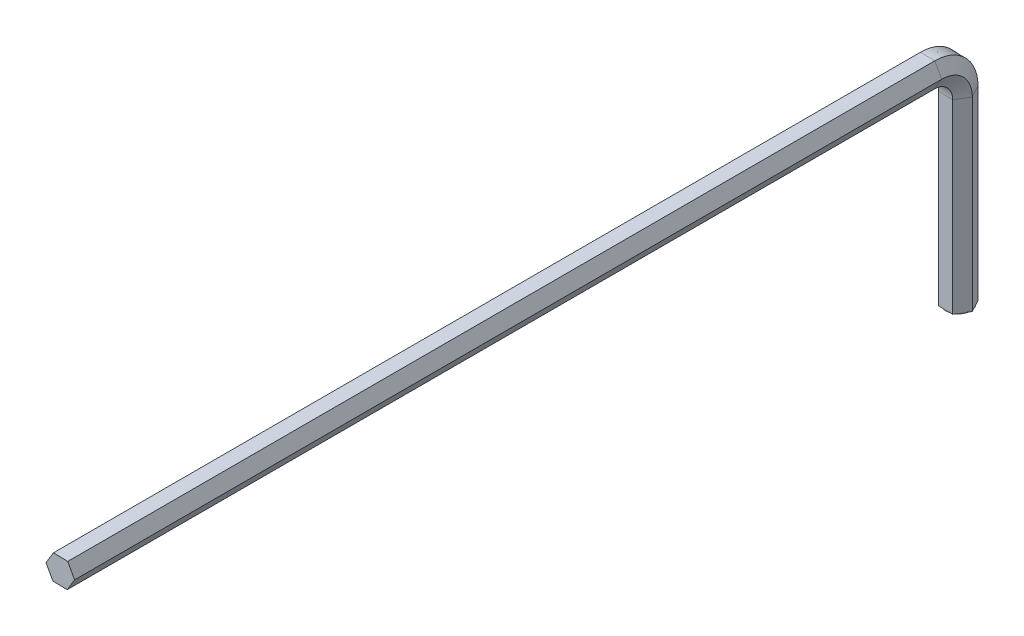
from build123d import *

# Parameters (mm, degrees)
SKETCH2_R           = 2
BOSS_EXTRUDE1_DEPTH = 0.1


with BuildPart() as part:
    # Sweep1: sweep along a curve in space
    with BuildLine() as sweep1_path:
        Line((0, 0, 0), (0, 30, 0))
        ThreePointArc((0, 35, 5), (0, 33.535533906, 1.464466094), (0, 30, 0))
        Line((0, 35, 5), (0, 35, 145))
    # Sketch1 → Sweep1 (sweep)
    with BuildSketch(Plane(origin=(0, 0, 0), x_dir=(-1, 0, 0), z_dir=(0, 1, 0))):
        Polygon((2.308874637, -0.049307649), (1.197138995, 1.974890265), (-1.111735642, 2.024197914), (-2.308874637, 0.049307649), (-1.197138995, -1.974890265), (1.111735642, -2.024197914), align=None)
    sweep(path=sweep1_path.line)

    # Sketch2 → Boss-Extrude1 (add)
    with BuildSketch(Plane.XZ):
        with Locations(Location((0, 0, 0), (0, 0, 91.223405883))):
            Circle(SKETCH2_R)
    extrude(amount=BOSS_EXTRUDE1_DEPTH)


solid = part.part
